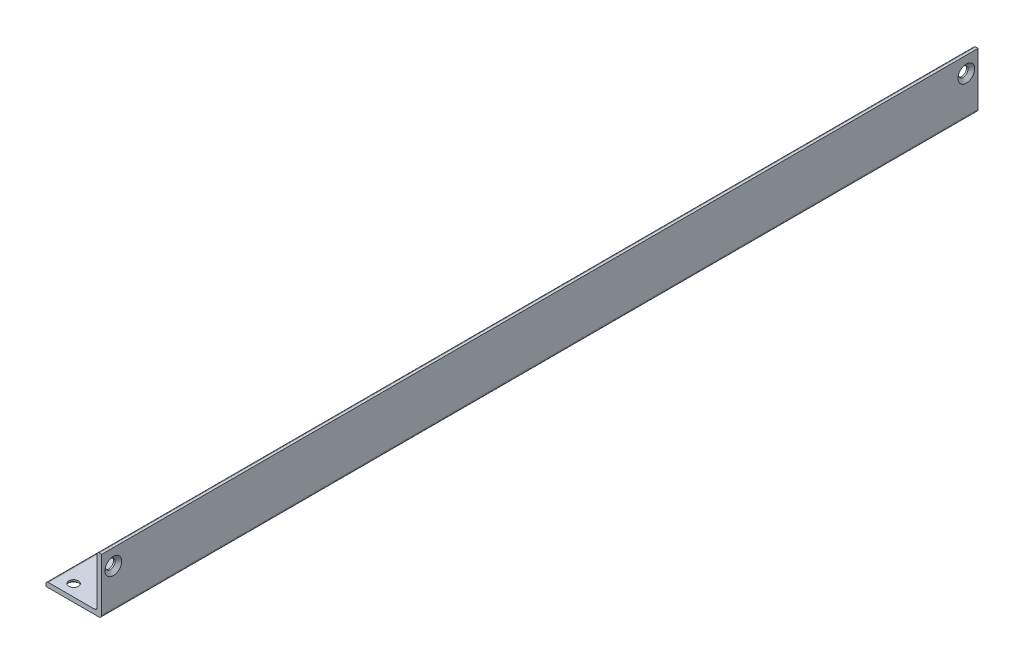
from build123d import *

# Parameters (mm, degrees)
BOSS_EXTRUDE1_DEPTH                               = 150
CSK_FOR_4_FLAT_HEAD_MACHINE_SCREW_100_D           = 3.2639
CSK_FOR_4_FLAT_HEAD_MACHINE_SCREW_100_CSINK_D     = 5.715
CSK_FOR_4_FLAT_HEAD_MACHINE_SCREW_100_CSINK_ANGLE = 100
CSK_FOR_4_FLAT_HEAD_MACHINE_SCREW_2_D             = 3.2639
CSK_FOR_4_FLAT_HEAD_MACHINE_SCREW_2_CSINK_D       = 5.715
CSK_FOR_4_FLAT_HEAD_MACHINE_SCREW_2_CSINK_ANGLE   = 100
FILLET1_R                                         = 1
F_2_CLEARANCE_HOLE1_AT_2_COUNT                    = 2
F_2_CLEARANCE_HOLE1_AT_2_PITCH                    = 4.8


with BuildPart() as part:
    # Sketch2 → Boss-Extrude1 (new, symmetric)
    with BuildSketch(Plane.XY):
        with BuildLine():
            Line((-9.525, 0), (9.525, 0))
            Line((9.525, 0), (9.525, 19.05))
            Line((9.525, 19.05), (8.73125, 19.05))
            ThreePointArc((8.73125, 19.05), (8.169983992, 18.817516008), (7.9375, 18.25625))
            Line((7.9375, 18.25625), (7.9375, 2.38125))
            ThreePointArc((7.9375, 2.38125), (7.705016008, 1.819983992), (7.14375, 1.5875))
            Line((7.14375, 1.5875), (-8.73125, 1.5875))
            ThreePointArc((-8.73125, 1.5875), (-9.292516008, 1.355016008), (-9.525, 0.79375))
            Line((-9.525, 0.79375), (-9.525, 0))
        make_face()
    extrude(amount=BOSS_EXTRUDE1_DEPTH, both=True)

    # CSK for _4 Flat Head Machine Screw _100 (through all)
    with Locations(Plane(origin=(0, 0, 0), x_dir=(-1, 0, 0), z_dir=(0, -1, 0))):
        with Locations((4.0625, -146), (4.0625, 146)):
            CounterSinkHole(CSK_FOR_4_FLAT_HEAD_MACHINE_SCREW_100_D / 2, CSK_FOR_4_FLAT_HEAD_MACHINE_SCREW_100_CSINK_D / 2, counter_sink_angle=CSK_FOR_4_FLAT_HEAD_MACHINE_SCREW_100_CSINK_ANGLE)

    # CSK for _4 Flat Head Machine Screw _ 2 (through all)
    with Locations(Plane(origin=(9.525, 0, 0), x_dir=(0, 0, -1), z_dir=(1, 0, 0))):
        with Locations((-146, 13.5875), (146, 13.5875)):
            CounterSinkHole(CSK_FOR_4_FLAT_HEAD_MACHINE_SCREW_2_D / 2, CSK_FOR_4_FLAT_HEAD_MACHINE_SCREW_2_CSINK_D / 2, counter_sink_angle=CSK_FOR_4_FLAT_HEAD_MACHINE_SCREW_2_CSINK_ANGLE)

    # Fillet1
    fillet1_edges = [part.edges().sort_by_distance(p)[0] for p in [
        (9.525, 0, 0),
    ]]
    fillet(fillet1_edges, radius=FILLET1_R)

    # Sketch30 → #2 Clearance Hole1 (revolve, cut)
    with BuildSketch(Plane(origin=(3.49375, 1.5875, 129.88), x_dir=(0, 0, 1), z_dir=(1, 0, 0))):
        Polygon((0, 0), (0, 1.5875), (2.0574, 1.5875), (1.2192, 0.623261201), (1.2192, 0), align=None)
    f_2_clearance_hole1 = revolve(axis=Axis((3.49375, 7.9375, 129.88), (0, -1, 0)), mode=Mode.SUBTRACT)

    # #2 Clearance Hole1 at 2: #2 Clearance Hole1 ×2
    with Locations(*[(0, 0, -i * F_2_CLEARANCE_HOLE1_AT_2_PITCH) for i in range(1, F_2_CLEARANCE_HOLE1_AT_2_COUNT)]):
        add(f_2_clearance_hole1, mode=Mode.SUBTRACT)


solid = part.part
